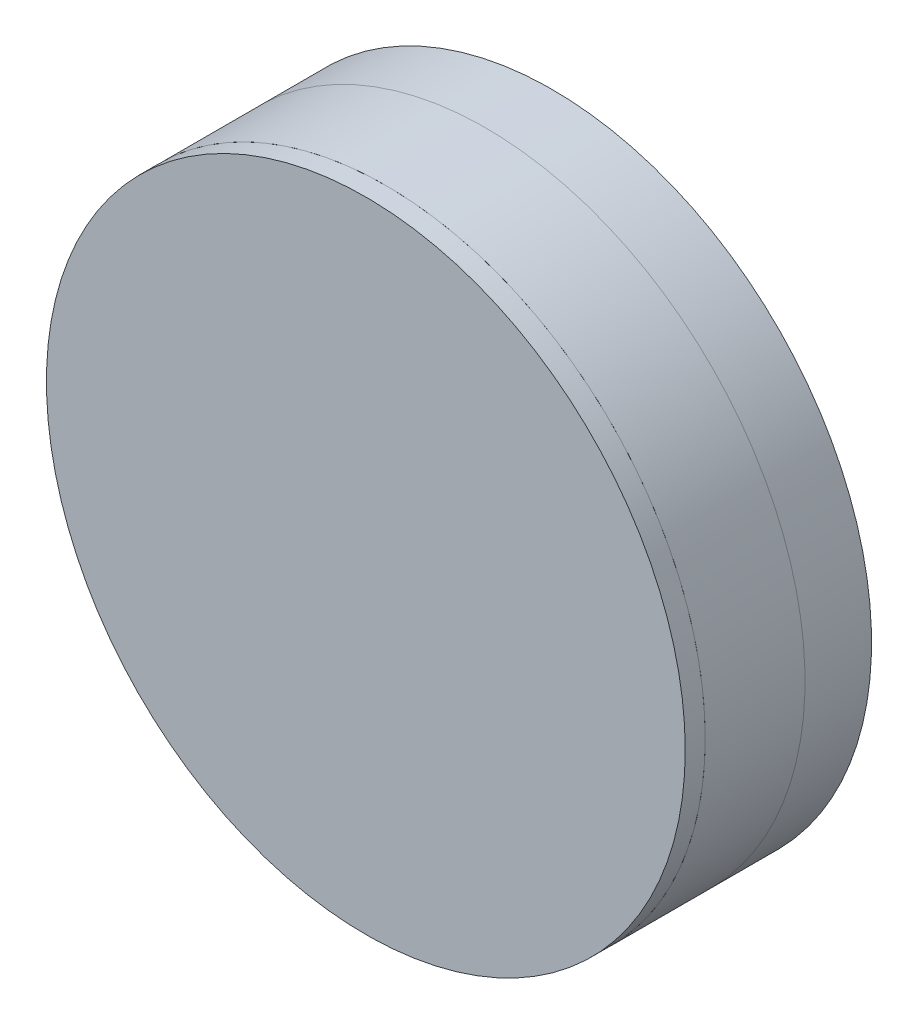
from build123d import *

# Parameters (mm, degrees)
SKETCH1_R           = 48
BOSS_EXTRUDE1_DEPTH = 3
SKETCH2_R           = 48
BOSS_EXTRUDE3_DEPTH = 15
SKETCH4_R           = 48
BOSS_EXTRUDE4_DEPTH = 10


with BuildPart() as part:
    # Sketch1 → Boss-Extrude1 (new body)
    with BuildSketch(Plane.XY):
        Circle(SKETCH1_R)
    extrude(amount=BOSS_EXTRUDE1_DEPTH)


with BuildPart() as body_2:
    # Sketch2 → Boss-Extrude3 (new body)
    with BuildSketch(Plane(origin=(0, 0, 0), x_dir=(-1, 0, 0), z_dir=(0, 0, -1))):
        Circle(SKETCH2_R)
    extrude(amount=BOSS_EXTRUDE3_DEPTH)


with BuildPart() as body_3:
    # Sketch4 → Boss-Extrude4 (new body)
    with BuildSketch(Plane(origin=(0, 0, -15), x_dir=(-1, 0, 0), z_dir=(0, 0, -1))):
        Circle(SKETCH4_R)
    extrude(amount=BOSS_EXTRUDE4_DEPTH)


solid = Compound([part.part, body_2.part, body_3.part])
